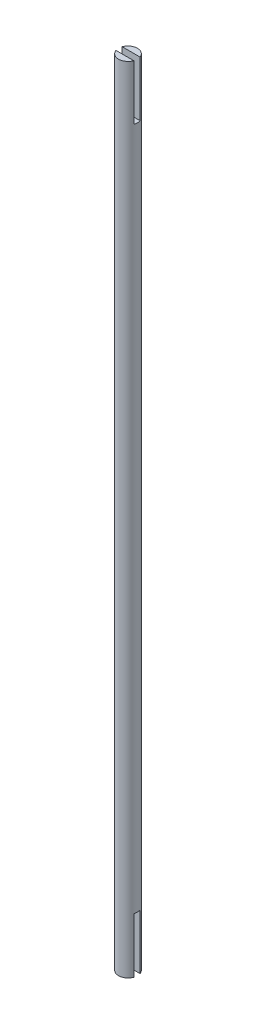
from build123d import *

# Parameters (mm, degrees)
SKETCH1_R               = 3
BOSS_EXTRUDE1_DEPTH     = 252
CUT_EXTRUDE2_DEPTH      = 253.035711755
CUT_EXTRUDE2_DEPTH_BACK = 253.035711755
SKETCH2_W               = 2
SKETCH2_H               = 17.5


with BuildPart() as part:
    # Sketch1 → Boss-Extrude1 (new body)
    with BuildSketch(Plane(origin=(0, 0, 0), x_dir=(1, 0, 0), z_dir=(0, 1, 0))):
        with Locations(Location((0, 0, 0), (0, 0, 270))):
            Circle(SKETCH1_R)
    extrude(amount=BOSS_EXTRUDE1_DEPTH)

    # Sketch2 → Cut-Extrude2 (cut, two sides: drawn at the far end of the back side and taken through both)
    with BuildSketch(Plane(origin=(0, 0, 0), x_dir=(0, 0, -1), z_dir=(1, 0, 0)).offset(-CUT_EXTRUDE2_DEPTH_BACK)):
        with Locations((0, 243.25)):
            Rectangle(SKETCH2_W, SKETCH2_H)
        with Locations((0, 8.75)):
            Rectangle(SKETCH2_W, SKETCH2_H)
    extrude(amount=CUT_EXTRUDE2_DEPTH + CUT_EXTRUDE2_DEPTH_BACK, mode=Mode.SUBTRACT)


solid = part.part
